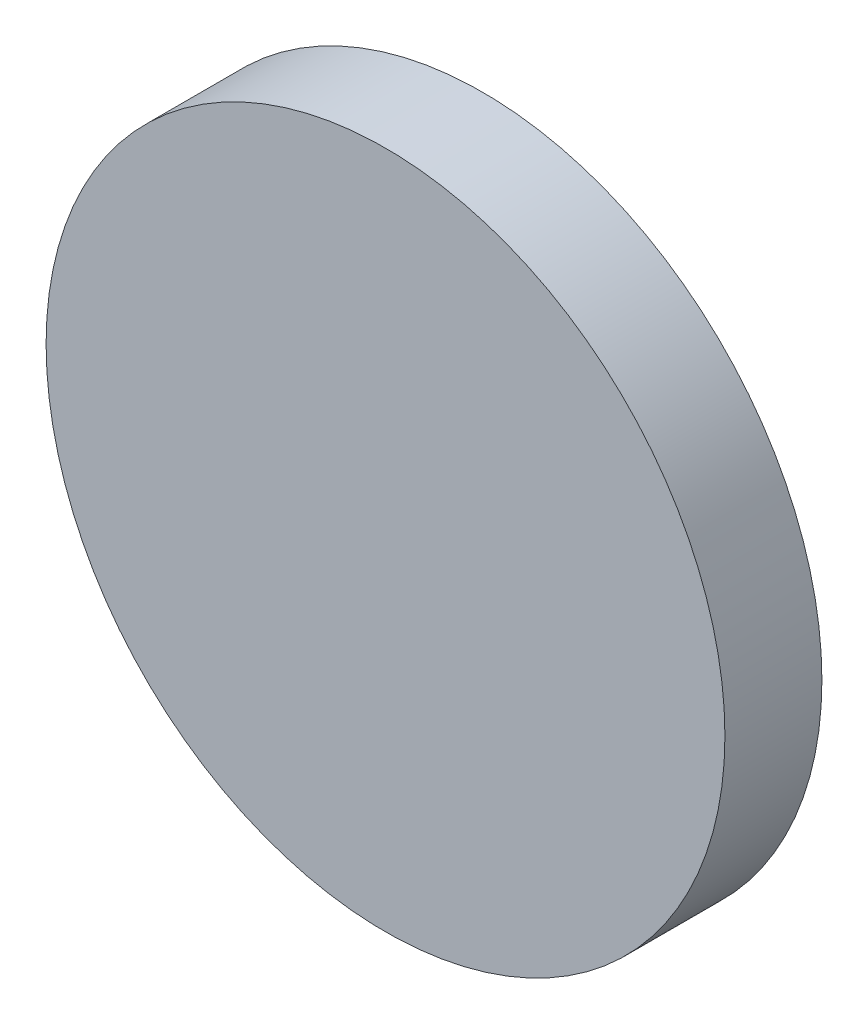
from build123d import *

# Parameters (mm, degrees)
SKETCH1_R           = 42
SKETCH1_R_2         = 40.25
BOSS_EXTRUDE1_DEPTH = 10
SKETCH2_R           = 42
BOSS_EXTRUDE2_DEPTH = 2


with BuildPart() as part:
    # Sketch1 → Boss-Extrude1 (new body)
    with BuildSketch(Plane.XY):
        Circle(SKETCH1_R)
        Circle(SKETCH1_R_2, mode=Mode.SUBTRACT)
    extrude(amount=BOSS_EXTRUDE1_DEPTH)

    # Sketch2 → Boss-Extrude2 (add)
    with BuildSketch(Plane.XY.offset(10)):
        Circle(SKETCH2_R)
    extrude(amount=BOSS_EXTRUDE2_DEPTH)


solid = part.part
